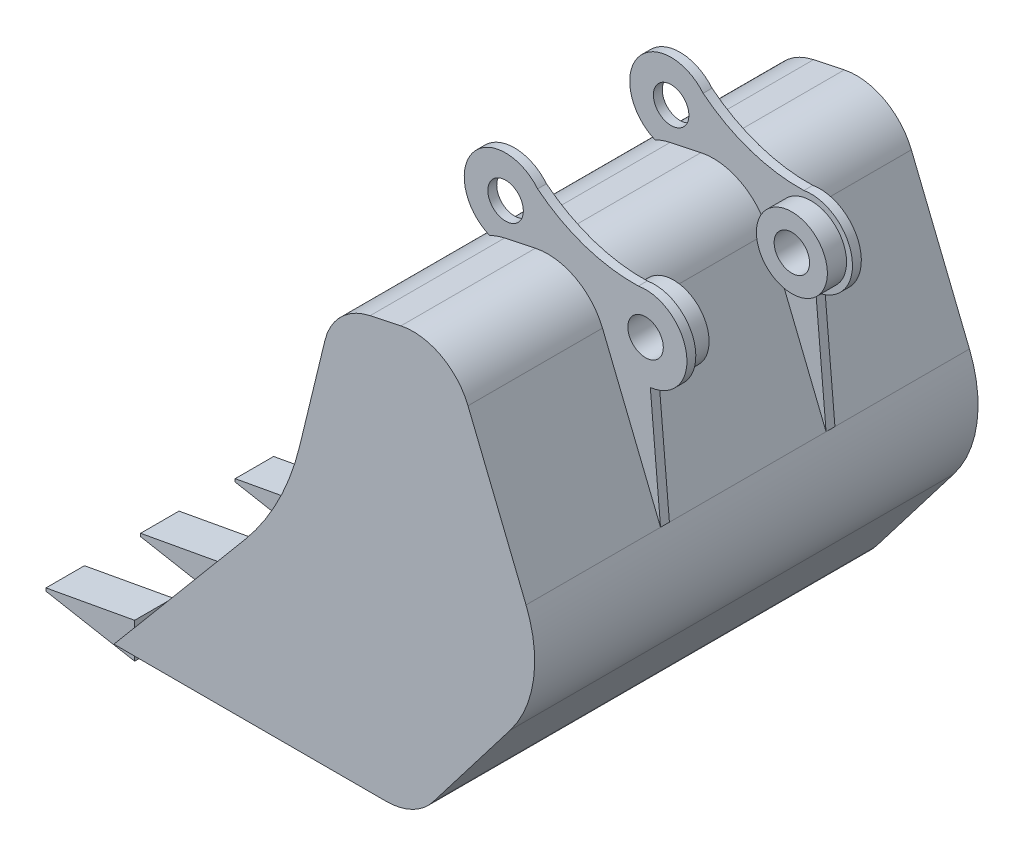
from build123d import *
from build123d.topology import SkipClean

# Parameters (mm, degrees)
BOSS_EXTRUDE4_DEPTH  = 375
BOSS_EXTRUDE5_DEPTH  = 7.5
CUT_EXTRUDE1_DEPTH   = 360
BOSS_EXTRUDE6_DEPTH  = 32.5
LPATTERN1_COUNT      = 3
LPATTERN1_PITCH      = 160
LPATTERN1_COUNT_DIR2 = 3
LPATTERN1_PITCH_DIR2 = 160
SKETCH11_R           = 30
CUT_EXTRUDE2_DEPTH   = 1263.512529339
SKETCH12_R           = 60
SKETCH12_R_2         = 30
BOSS_EXTRUDE7_DEPTH  = 32.5
SCALE_1_SCALE        = 0.1


with BuildPart() as part:
    # Sketch1 → Boss-Extrude4 (new, symmetric)
    with BuildSketch(Plane.XY):
        with BuildLine():
            Line((281.569977344, 264.00526259), (60.043258876, 0))
            Line((60.043258876, 0), (520.65961219, 0))
            ThreePointArc((520.65961219, 0), (564.907123778, 10.321921752), (600.02024832, 39.156845634))
            Line((600.02024832, 39.156845634), (730.44724808, 209.279019234))
            ThreePointArc((730.44724808, 209.279019234), (769.910899903, 304.081580706), (757.128519442, 405.97130652))
            Line((757.128519442, 405.97130652), (658.940406775, 648.676304078))
            ThreePointArc((658.940406775, 648.676304078), (613.16613298, 699.478789474), (545.447965883, 708.988074874))
            Line((545.447965883, 708.988074874), (493.401915404, 697.925345336))
            ThreePointArc((493.401915404, 697.925345336), (444.503904969, 671.828213907), (417.014937982, 623.698884104))
            Line((417.014937982, 623.698884104), (374.151637205, 447.112342165))
            ThreePointArc((374.151637205, 447.112342165), (338.436231819, 350.211710608), (281.569977344, 264.00526259))
        make_face()
    extrude(amount=BOSS_EXTRUDE4_DEPTH, both=True)

    # Sketch6 → Boss-Extrude5 (add, symmetric)
    with BuildSketch(Plane.XY.offset(140)):
        with BuildLine():
            Line((739.837232288, 602.21499348), (757.128519442, 405.97130652))
            Line((757.128519442, 405.97130652), (468.079651675, 688.843619215))
            ThreePointArc((468.079651675, 688.843619215), (438.909700759, 795.263431413), (549.226629435, 797.76097261))
            ThreePointArc((549.226629435, 797.76097261), (629.357941615, 754.030269249), (719.665800913, 740.692647386))
            ThreePointArc((719.665800913, 740.692647386), (801.063667795, 681.841548153), (739.837232288, 602.21499348))
        make_face()
    boss_extrude5 = extrude(amount=BOSS_EXTRUDE5_DEPTH, both=True)

    # Mirror2: Boss-Extrude5 across plane
    add(boss_extrude5.mirror(Plane.XY))

    # Sketch7 → Cut-Extrude1 (cut, symmetric)
    with BuildSketch(Plane.XY):
        with BuildLine():
            Line((60.410578327, 15), (329.990480538, 400))
            Line((329.990480538, 400), (404.359842809, 650))
            Line((404.359842809, 650), (608.375948196, 693.364961886))
            Line((608.375948196, 693.364961886), (698.639094975, 432.530508414))
            ThreePointArc((698.639094975, 432.530508414), (712.247197771, 292.899677108), (660.880251772, 162.349355884))
            Line((660.880251772, 162.349355884), (557.705122032, 15))
            Line((557.705122032, 15), (60.410578327, 15))
        make_face()
    extrude(amount=CUT_EXTRUDE1_DEPTH, both=True, mode=Mode.SUBTRACT)

    # Sketch10 → Boss-Extrude6 (add, symmetric)
    with BuildSketch(Plane.XY):
        Polygon((72.542939803, 30), (-77.392739815, 2.5), (-77.392739815, -2.5), (72.542939803, -30), (72.542939803, 0), align=None)
    boss_extrude6 = extrude(amount=BOSS_EXTRUDE6_DEPTH, both=True)

    # LPattern1: Boss-Extrude6 3 × 3
    with Locations(*[Vector(0, 0, 1) * (i * LPATTERN1_PITCH) + Vector(0, 0, -1) * (j * LPATTERN1_PITCH_DIR2) for i in range(LPATTERN1_COUNT) for j in range(LPATTERN1_COUNT_DIR2) if (i, j) != (0, 0)]):
        add(boss_extrude6)

    # Sketch11 → Cut-Extrude2 (cut, through all)
    with BuildSketch(Plane.XY.offset(147.5)):
        with Locations((495.043258876, 753.442101292)):
            Circle(SKETCH11_R)
        with Locations((731.794701004, 671.751442127)):
            Circle(SKETCH11_R)
    extrude(amount=-CUT_EXTRUDE2_DEPTH, mode=Mode.SUBTRACT)

    # Sketch12 → Boss-Extrude7 (add)
    with SkipClean():  # the faces are left unmerged after this step: merging them gives an invalid solid
        with BuildSketch(Plane(origin=(0, 0, 132.5), x_dir=(-1, 0, 0), z_dir=(0, 0, -1))):
            with Locations((-731.794701004, 671.751442127)):
                Circle(SKETCH12_R)
            with Locations((-731.794701004, 671.751442127)):
                Circle(SKETCH12_R_2, mode=Mode.SUBTRACT)
        boss_extrude7 = extrude(amount=BOSS_EXTRUDE7_DEPTH)

    # Mirror3: Boss-Extrude7 across plane
    add(boss_extrude7.mirror(Plane.XY))


with BuildPart() as part_1:
    # 缩放比例1: scaled about (560.789704791, 327.896781874, 0)
    add(part.part.scale(SCALE_1_SCALE).moved(Location((504.710734312, 295.107103687, 0))))


solid = part_1.part
